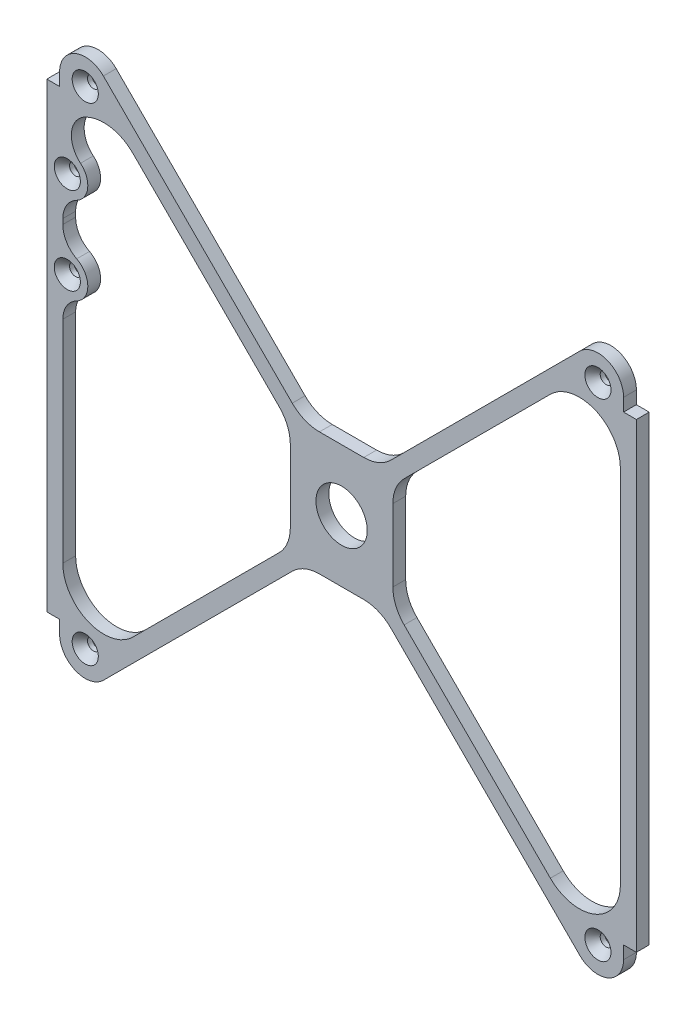
from build123d import *

# Parameters (mm, degrees)
BOSS_EXTRUDE1_DEPTH           = 3.175
MIRROR2_COPY_1_DEPTH          = 3.175
INTERNAL_SHARPS_R             = 9.525
IMU_MOUNTING_DEPTH            = 3.175
IMU_MOUNTING_HOLES_AT_2_COUNT = 2
IMU_MOUNTING_HOLES_AT_2_PITCH = 21.59
FILLET4_R                     = 6.35
SKETCH6_R                     = 6.35
MATERIAL_REMOVAL_DEPTH        = 99.935771608


with BuildPart() as part:
    # Sketch1 → Boss-Extrude1 (new body)
    with BuildSketch(Plane.XY):
        with BuildLine():
            Line((9.434743879, 15.24), (0, 15.24))
            Line((0, 15.24), (0, 0))
            Line((0, 0), (12.7, 0))
            Line((12.7, 0), (12.7, 12.892596045))
            Line((12.7, 12.892596045), (51.712045103, 51.904641149))
            ThreePointArc((51.712045103, 51.904641149), (62.784313673, 54.107052302), (69.05625, 44.720436252))
            Line((69.05625, 44.720436252), (69.05625, 0))
            Line((69.05625, 0), (73.025, 0))
            Line((73.025, 0), (73.025, 57.15))
            Line((73.025, 57.15), (69.85, 57.15))
            Line((69.85, 57.15), (69.85, 60.325))
            ThreePointArc((69.85, 60.325), (65.930039796, 66.191635031), (59.009871939, 64.815128061))
            Line((59.009871939, 64.815128061), (9.434743879, 15.24))
        make_face()
    boss_extrude1 = extrude(amount=BOSS_EXTRUDE1_DEPTH)

    # Sketch11 → CSK for #4 Flat Head Machine Screw1 (revolve, cut)
    with BuildSketch(Plane(origin=(63.5, 60.325, 3.175), x_dir=(0, -1, 0), z_dir=(1, 0, 0))):
        Polygon((0, 0), (0, 3.175), (1.4732, 3.175), (1.4732, 2.030745349), (3.2385, 0), align=None)
    csk_for_4_flat_head_machine_screw1 = revolve(axis=Axis((63.5, 60.325, 9.525), (0, 0, -1)), mode=Mode.SUBTRACT)

    # Mirror1: Boss-Extrude1, CSK for #4 Flat Head Machine Screw1 across plane
    add(boss_extrude1.mirror(Plane.ZX))
    add(csk_for_4_flat_head_machine_screw1.mirror(Plane.ZX), mode=Mode.SUBTRACT)

    # Mirror2: Boss-Extrude1, CSK for #4 Flat Head Machine Screw1 across plane
    add(boss_extrude1.mirror(Plane(origin=(0, 0, 0), x_dir=(0, 0, 1), z_dir=(1, 0, 0))))
    add(csk_for_4_flat_head_machine_screw1.mirror(Plane(origin=(0, 0, 0), x_dir=(0, 0, 1), z_dir=(1, 0, 0))), mode=Mode.SUBTRACT)

    # Mirror2 copy 1 sketch → Mirror2 copy 1 (add)
    with BuildSketch(Plane(origin=(0, 0, 0), x_dir=(-1, 0, 0), z_dir=(0, 0, 1))):
        with BuildLine():
            Line((9.434743879, 15.24), (0, 15.24))
            Line((0, 15.24), (0, 0))
            Line((0, 0), (12.7, 0))
            Line((12.7, 0), (12.7, 12.892596045))
            Line((12.7, 12.892596045), (51.712045103, 51.904641149))
            ThreePointArc((51.712045103, 51.904641149), (62.784313673, 54.107052302), (69.05625, 44.720436252))
            Line((69.05625, 44.720436252), (69.05625, 0))
            Line((69.05625, 0), (73.025, 0))
            Line((73.025, 0), (73.025, 57.15))
            Line((73.025, 57.15), (69.85, 57.15))
            Line((69.85, 57.15), (69.85, 60.325))
            ThreePointArc((69.85, 60.325), (65.930039796, 66.191635031), (59.009871939, 64.815128061))
            Line((59.009871939, 64.815128061), (9.434743879, 15.24))
        make_face()
    extrude(amount=MIRROR2_COPY_1_DEPTH)

    # Mirror2 copy 2 sketch → Mirror2 copy 2 (revolve, cut)
    with BuildSketch(Plane(origin=(-63.5, -60.325, 3.175), x_dir=(0, 1, 0), z_dir=(-1, 0, 0))):
        Polygon((0, 0), (0, 3.175), (1.4732, 3.175), (1.4732, 2.030745349), (3.2385, 0), align=None)
    revolve(axis=Axis((-63.5, -60.325, 9.525), (0, 0, -1)), mode=Mode.SUBTRACT)

    # INTERNAL-SHARPS
    internal_sharps_edges = [part.edges().sort_by_distance(p)[0] for p in [
        (-9.434743879, 15.24, 1.5875),
        (-12.7, 12.892596045, 1.5875),
        (9.434743879, 15.24, 1.5875),
        (12.7, 12.892596045, 1.5875),
        (9.434743879, -15.24, 1.5875),
        (12.7, -12.892596045, 1.5875),
        (-12.7, -12.892596045, 1.5875),
        (-9.434743879, -15.24, 1.5875),
    ]]
    fillet(internal_sharps_edges, radius=INTERNAL_SHARPS_R)

    # Sketch13 → IMU-MOUNTING (add)
    with BuildSketch(Plane.XY):
        with BuildLine():
            Line((-73.025, 44.45), (-73.025, 12.7))
            Line((-73.025, 12.7), (-67.945, 12.7))
            ThreePointArc((-67.945, 12.7), (-62.895851895, 18.339020045), (-69.05625, 22.736967161))
            Line((-69.05625, 22.736967161), (-69.05625, 34.413032839))
            ThreePointArc((-69.05625, 34.413032839), (-62.895851895, 38.810979955), (-67.945, 44.45))
            Line((-67.945, 44.45), (-73.025, 44.45))
        make_face()
    extrude(amount=IMU_MOUNTING_DEPTH)

    # Sketch15 → IMU-MOUNTING-HOLES (revolve, cut)
    with BuildSketch(Plane(origin=(-67.945, 17.78, 3.175), x_dir=(0, -1, 0), z_dir=(1, 0, 0))):
        Polygon((0, 0), (0, 3.175), (1.4732, 3.175), (1.4732, 2.030745349), (3.2385, 0), align=None)
    imu_mounting_holes = revolve(axis=Axis((-67.945, 17.78, 9.525), (0, 0, -1)), mode=Mode.SUBTRACT)

    # IMU-MOUNTING-HOLES at 2: IMU-MOUNTING-HOLES ×2
    with Locations(*[(0, i * IMU_MOUNTING_HOLES_AT_2_PITCH, 0) for i in range(1, IMU_MOUNTING_HOLES_AT_2_COUNT)]):
        add(imu_mounting_holes, mode=Mode.SUBTRACT)

    # Fillet4
    fillet4_edges = [part.edges().sort_by_distance(p)[0] for p in [
        (-69.05625, 44.45, 1.5875),
        (-69.05625, 12.7, 1.5875),
        (-69.05625, 22.736967161, 1.5875),
        (-69.05625, 34.413032839, 1.5875),
    ]]
    fillet(fillet4_edges, radius=FILLET4_R)

    # Sketch6 → MATERIAL-REMOVAL (cut, through all)
    with BuildSketch(Plane(origin=(0, 0, 0), x_dir=(-1, 0, 0), z_dir=(0, 0, -1))):
        Circle(SKETCH6_R)
    extrude(amount=-MATERIAL_REMOVAL_DEPTH, mode=Mode.SUBTRACT)


solid = part.part
